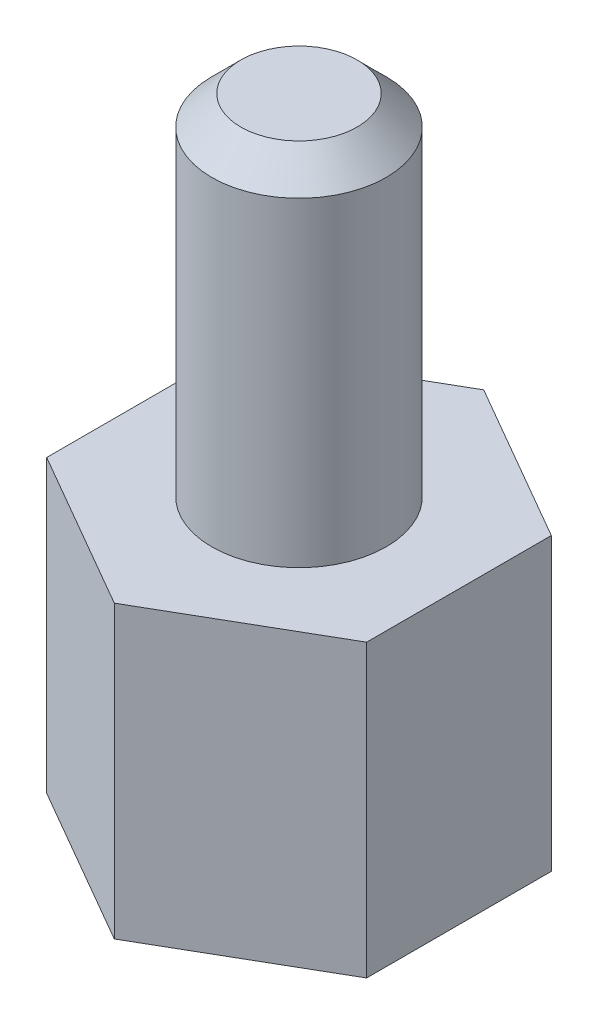
from build123d import *

# Parameters (mm, degrees)
EXTRUDE_1_DEPTH       = 5
SKETCH_2_R            = 1.5
EXTRUDE_2_DEPTH       = 6
CHAMFER_1_SIZE        = 0.5
HOLE_WIZARD_M31_D     = 2.5
HOLE_WIZARD_M31_DEPTH = 8.5
HOLE_WIZARD_M31_TIP   = 0.751075774


with BuildPart() as part:
    # Эскиз1 → Бобышка-Вытянуть1 (new body)
    with BuildSketch(Plane(origin=(0, 0, 0), x_dir=(1, 0, 0), z_dir=(0, 1, 0))):
        Polygon((0, 3.175426481), (-2.75, 1.58771324), (-2.75, -1.58771324), (0, -3.175426481), (2.75, -1.58771324), (2.75, 1.58771324), align=None)
    extrude(amount=EXTRUDE_1_DEPTH)

    # Эскиз2 → Бобышка-Вытянуть2 (add)
    with BuildSketch(Plane(origin=(0, 5, 0), x_dir=(1, 0, 0), z_dir=(0, 1, 0))):
        with Locations(Location((0, 0, 0), (0, 0, 270))):
            Circle(SKETCH_2_R)
    extrude(amount=EXTRUDE_2_DEPTH)

    # Фаска1
    chamfer_1_edges = [part.edges().sort_by_distance(p)[0] for p in [
        (0, 11, -1.5),
    ]]
    chamfer(chamfer_1_edges, length=CHAMFER_1_SIZE)

    # Отверстие обработанное метчиком M31
    with Locations(Plane(origin=(0, 0, 0), x_dir=(-1, 0, 0), z_dir=(0, -1, 0))):
        with Locations((0, 0)):
            Hole(HOLE_WIZARD_M31_D / 2, depth=HOLE_WIZARD_M31_DEPTH)
            with Locations((0, 0, -(HOLE_WIZARD_M31_DEPTH + HOLE_WIZARD_M31_TIP / 2))):  # 118° drill point
                Cone(0, HOLE_WIZARD_M31_D / 2, HOLE_WIZARD_M31_TIP, mode=Mode.SUBTRACT)


solid = part.part
